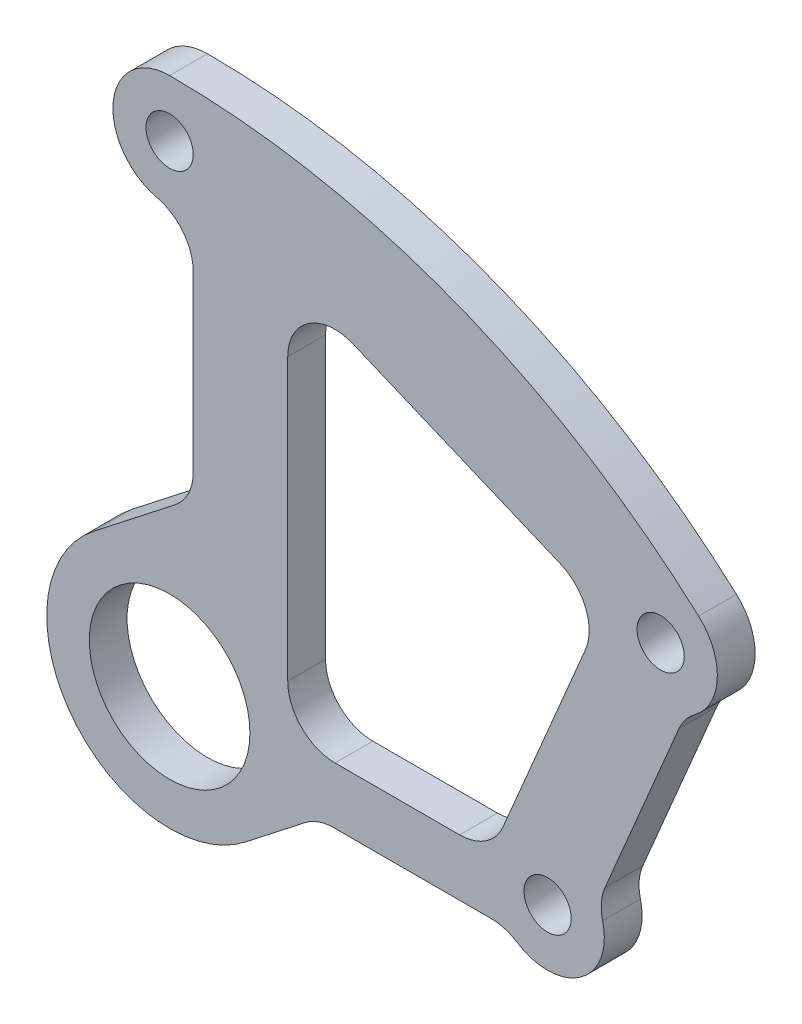
from build123d import *

# Parameters (mm, degrees)
SKETCH1_R           = 17
SKETCH1_R_2         = 5
BOSS_EXTRUDE1_DEPTH = 4


with BuildPart() as part:
    # Sketch1 → Boss-Extrude1 (new, symmetric)
    with BuildSketch(Plane.XY):
        with BuildLine():
            Line((5, 78.575714714), (5, 41.77822761))
            ThreePointArc((5, 41.77822761), (3.987940463, 37.394516142), (1.156614753, 33.898120074))
            Line((1.156614753, 33.898120074), (-16.007198358, 20.488279594))
            ThreePointArc((-16.007198358, 20.488279594), (-20.488279594, -16.007198358), (16.007198358, -20.488279594))
            Line((16.007198358, -20.488279594), (28.65699687, -10.605173838))
            ThreePointArc((28.65699687, -10.605173838), (31.557930079, -9.030095618), (34.813611624, -8.485281374))
            Line((34.813611624, -8.485281374), (68.071279511, -8.485281374))
            ThreePointArc((68.071279511, -8.485281374), (70.897583966, -8.892992642), (73.493425188, -10.08288075))
            ThreePointArc((73.493425188, -10.08288075), (86.982957468, -9.759011477), (91.643297853, 2.904068715))
            ThreePointArc((91.643297853, 2.904068715), (91.376524695, 6.104282152), (92.137861813, 9.224041719))
            Line((92.137861813, 9.224041719), (107.806206108, 46.218943848))
            ThreePointArc((107.806206108, 46.218943848), (109.157818303, 48.505648792), (111.063780403, 50.355833512))
            ThreePointArc((111.063780403, 50.355833512), (115.90879124, 59.4152181), (111.968703818, 68.903225806))
            ThreePointArc((111.968703818, 68.903225806), (59.988170877, 100.853839718), (0, 112))
            ThreePointArc((0, 112), (-11.921234951, 101.372646075), (-2.727272727, 88.314026208))
            ThreePointArc((-2.727272727, 88.314026208), (2.833494518, 84.791530319), (5, 78.575714714))
        make_face()
        Circle(SKETCH1_R, mode=Mode.SUBTRACT)
        with Locations((0, 100)):
            Circle(SKETCH1_R_2, mode=Mode.SUBTRACT)
        with Locations((80, 0)):
            Circle(SKETCH1_R_2, mode=Mode.SUBTRACT)
        with Locations((103.923048454, 60)):
            Circle(SKETCH1_R_2, mode=Mode.SUBTRACT)
        with BuildLine():
            Line((25, 72.976113171), (25, 13.514718626))
            ThreePointArc((25, 13.514718626), (27.928932188, 6.443650814), (35, 3.514718626))
            Line((35, 3.514718626), (61.375366857, 3.514718626))
            ThreePointArc((61.375366857, 3.514718626), (66.898085507, 5.178077893), (70.583551108, 9.614802884))
            Line((70.583551108, 9.614802884), (88.006080219, 50.7515527))
            ThreePointArc((88.006080219, 50.7515527), (88.058512057, 58.42519202), (82.657599567, 63.876580264))
            Line((82.657599567, 63.876580264), (38.8597036, 82.201224993))
            ThreePointArc((38.8597036, 82.201224993), (29.459108194, 81.300686313), (25, 72.976113171))
        make_face(mode=Mode.SUBTRACT)
    extrude(amount=BOSS_EXTRUDE1_DEPTH, both=True)


solid = part.part
